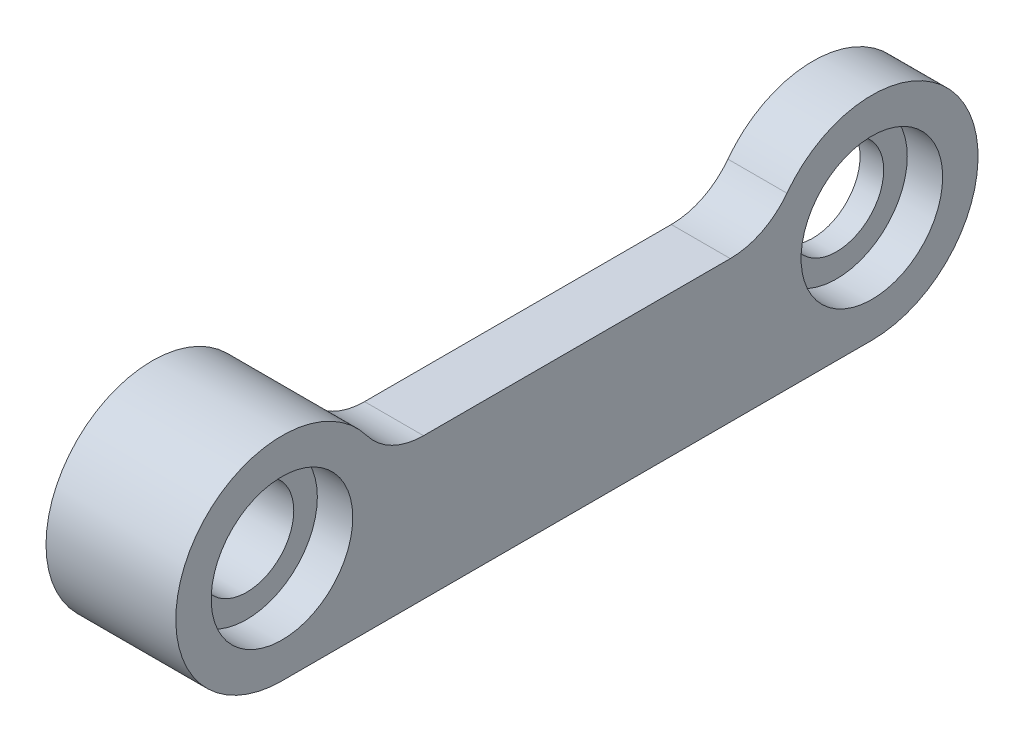
from build123d import *

# Parameters (mm, degrees)
SKETCH_1_R               = 4.5
SKETCH_1_W               = 25
SKETCH_1_H               = 6
EXTRUDE_1_DEPTH          = 2.5
EXTRUDE_START            = -3
SKETCH_1_5_R             = 4.5
EXTRUDE_3_DEPTH          = 3
CUT_EXTRUDE_2_DEPTH      = 31.253099015
CUT_EXTRUDE_2_DEPTH_BACK = 31.253099015
SKETCH_1_4_R             = 2
FILLET_1_R               = 3
SKETCH_2_R               = 3
CUT_EXTRUDE_3_DEPTH      = 1.5
CUT_EXTRUDE_4_DEPTH      = 31.797727189
CUT_EXTRUDE_4_DEPTH_BACK = 31.797727189
SKETCH_3_W               = 41.902473513
SKETCH_3_H               = 17.131219194


with BuildPart() as part:
    # 草图1 → 凸台-拉伸1 (new body)
    with BuildSketch(Plane(origin=(0, 0, 0), x_dir=(0, 0, -1), z_dir=(1, 0, 0))):
        with Locations((0, -1.5)):
            Circle(SKETCH_1_R)
        with Locations((25, -1.5)):
            Circle(SKETCH_1_R)
        with Locations((12.5, -3)):
            Rectangle(SKETCH_1_W, SKETCH_1_H)
    extrude(amount=EXTRUDE_1_DEPTH)

    # 草图1<5> → 凸台-拉伸3 (add)
    with BuildSketch(Plane(origin=(0, 0, 0), x_dir=(0, 0, -1), z_dir=(1, 0, 0)).offset(EXTRUDE_START)):
        with Locations((0, -1.5)):
            Circle(SKETCH_1_5_R)
    extrude(amount=EXTRUDE_3_DEPTH)

    # 草图1<4> → 切除-拉伸2 (cut, two sides: drawn at the far end of the back side and taken through both)
    with BuildSketch(Plane(origin=(0, 0, 0), x_dir=(0, 0, -1), z_dir=(1, 0, 0)).offset(-CUT_EXTRUDE_2_DEPTH_BACK)):
        with Locations((0, -1.5)):
            Circle(SKETCH_1_4_R)
        with Locations((25, -1.5)):
            Circle(SKETCH_1_4_R)
    extrude(amount=CUT_EXTRUDE_2_DEPTH + CUT_EXTRUDE_2_DEPTH_BACK, mode=Mode.SUBTRACT)

    # 圆角1
    fillet_1_edges = [part.edges().sort_by_distance(p)[0] for p in [
        (1.25, 0, -20.757359313),
        (1.25, 0, -4.242640687),
    ]]
    fillet(fillet_1_edges, radius=FILLET_1_R)

    # 草图2 → 切除-拉伸3 (cut)
    with BuildSketch(Plane(origin=(2.5, 0, 0), x_dir=(0, 0, -1), z_dir=(1, 0, 0))):
        with Locations((0, -1.5)):
            Circle(SKETCH_2_R)
        with Locations((25, -1.5)):
            Circle(SKETCH_2_R)
    extrude(amount=-CUT_EXTRUDE_3_DEPTH, mode=Mode.SUBTRACT)


with BuildPart() as body_2:
    # 镜向2: mirrored copy
    add(part.part.mirror(Plane(origin=(3.5, 0, 0), x_dir=(0, 0, 1), z_dir=(1, 0, 0))))

    # 草图3 → 切除-拉伸4 (cut, two sides: drawn at the far end of the back side and taken through both)
    with BuildSketch(Plane(origin=(3.5, 0, 0), x_dir=(0, 0, -1), z_dir=(1, 0, 0)).offset(-CUT_EXTRUDE_4_DEPTH_BACK)):
        with Locations((12.668553329, -1.632419341)):
            Rectangle(SKETCH_3_W, SKETCH_3_H)
    extrude(amount=CUT_EXTRUDE_4_DEPTH + CUT_EXTRUDE_4_DEPTH_BACK, mode=Mode.SUBTRACT)


solid = part.part
